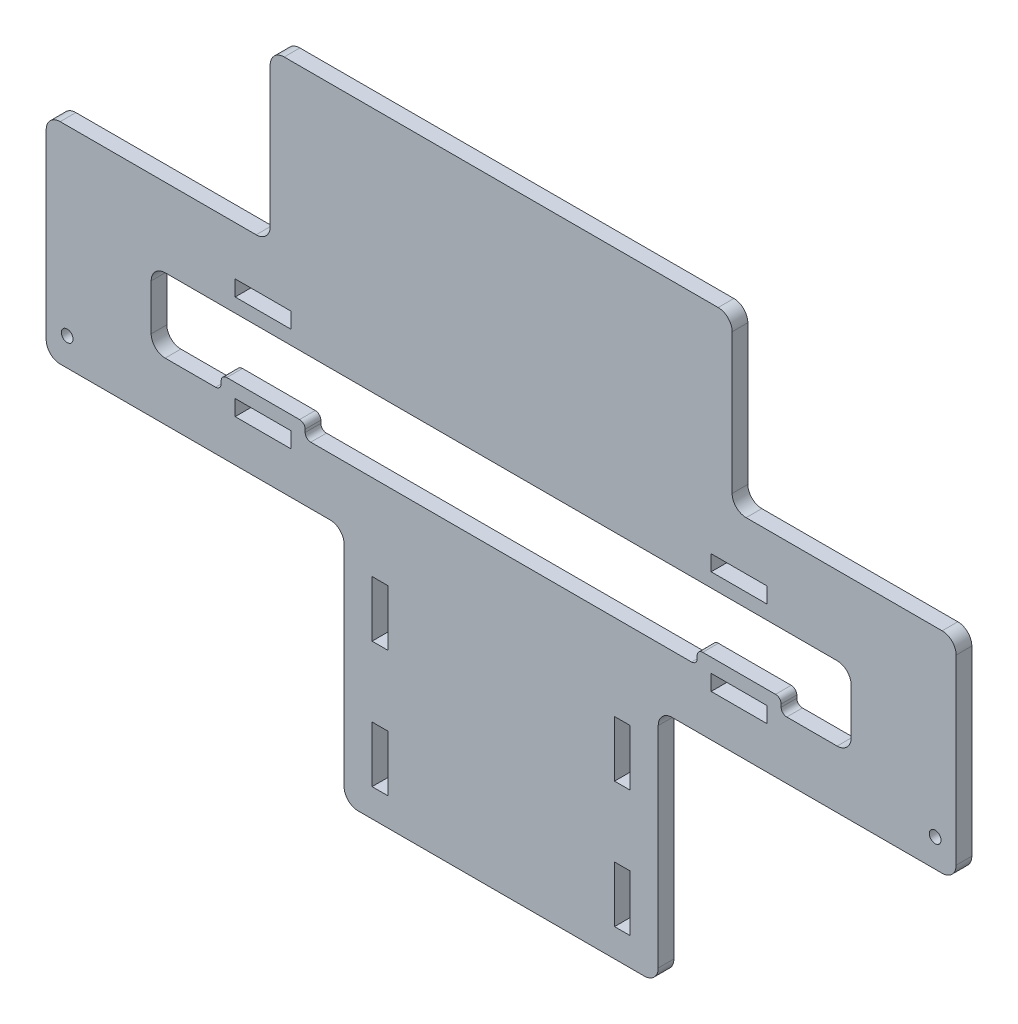
from build123d import *

# Parameters (mm, degrees)
SKETCH_1_W          = 325
SKETCH_1_H          = 230
SKETCH_1_R          = 2.1
EXTRUDE_1_DEPTH     = 5.6
SKETCH_2_W          = 5.6
SKETCH_2_H          = 20
SKETCH_2_W_2        = 20
SKETCH_2_H_2        = 5.6
CUT_EXTRUDE_1_DEPTH = 200.154738834
SKETCH_3_R          = 2.1
SKETCH_3_W          = 56.1
SKETCH_3_H          = 10
CUT_EXTRUDE_2_DEPTH = 200.154738834
CUT_EXTRUDE_3_DEPTH = 200.154738834
SKETCH_5_W          = 80
SKETCH_5_H          = 60
CUT_EXTRUDE_4_DEPTH = 200.154738834
FILLET_1_R          = 5
FILLET_2_R          = 2


with BuildPart() as part:
    # ｽｹｯﾁ1 → ﾎﾞｽ - 押し出し1 (new body)
    with BuildSketch(Plane.XY):
        Rectangle(SKETCH_1_W, SKETCH_1_H)
        with Locations((155, 110)):
            Circle(SKETCH_1_R, mode=Mode.SUBTRACT)
        with Locations(Location((155, -110, 0), (0, 0, 180))):
            Circle(SKETCH_1_R, mode=Mode.SUBTRACT)
        with Locations(Location((-155, 110, 0), (0, 0, 180))):
            Circle(SKETCH_1_R, mode=Mode.SUBTRACT)
        with Locations((-155, -110)):
            Circle(SKETCH_1_R, mode=Mode.SUBTRACT)
        with Locations((155, -10)):
            Circle(SKETCH_1_R, mode=Mode.SUBTRACT)
        with Locations(Location((-155, -10, 0), (0, 0, 180))):
            Circle(SKETCH_1_R, mode=Mode.SUBTRACT)
    extrude(amount=EXTRUDE_1_DEPTH)

    # ｽｹｯﾁ2 → ｶｯﾄ - 押し出し1 (cut, through all)
    with BuildSketch(Plane.XY.offset(5.6)):
        with Locations((43.3, -40)):
            Rectangle(SKETCH_2_W, SKETCH_2_H)
        with Locations((-43.3, -40)):
            Rectangle(SKETCH_2_W, SKETCH_2_H)
        with Locations((43.3, -85)):
            Rectangle(SKETCH_2_W, SKETCH_2_H)
        with Locations((-43.3, -85)):
            Rectangle(SKETCH_2_W, SKETCH_2_H)
        with Locations((85, -2.2)):
            Rectangle(SKETCH_2_W_2, SKETCH_2_H_2)
        with Locations((-85, -2.2)):
            Rectangle(SKETCH_2_W_2, SKETCH_2_H_2)
        with Locations((85, 34.8)):
            Rectangle(SKETCH_2_W_2, SKETCH_2_H_2)
        with Locations((-85, 34.8)):
            Rectangle(SKETCH_2_W_2, SKETCH_2_H_2)
    extrude(amount=-CUT_EXTRUDE_1_DEPTH, mode=Mode.SUBTRACT)

    # ｽｹｯﾁ3 → ｶｯﾄ - 押し出し2 (cut, through all)
    # profile 1 of 4: a face of its own
    with BuildSketch(Plane.XY.offset(5.6)):
        Polygon((-56.1, -115), (-56.1, -105), (-56.1, -20), (-162.5, -20), (-162.5, -115), align=None)
        with Locations((-155, -110)):
            Circle(SKETCH_3_R, mode=Mode.SUBTRACT)
    # profile 2 of 4: a face of its own
    with BuildSketch(Plane.XY.offset(5.6)):
        with Locations((-28.05, -110)):
            Rectangle(SKETCH_3_W, SKETCH_3_H)
    # profile 3 of 4: a face of its own
    with BuildSketch(Plane.XY.offset(5.6)):
        with Locations((28.05, -110)):
            Rectangle(SKETCH_3_W, SKETCH_3_H)
    # profile 4 of 4: a face of its own
    with BuildSketch(Plane.XY.offset(5.6)):
        Polygon((56.1, -20), (56.1, -105), (56.1, -115), (162.5, -115), (162.5, -20), align=None)
        with Locations((155, -110)):
            Circle(SKETCH_3_R, mode=Mode.SUBTRACT)
    extrude(amount=-CUT_EXTRUDE_2_DEPTH, mode=Mode.SUBTRACT)

    # ｽｹｯﾁ4 → ｶｯﾄ - 押し出し3 (cut, through all)
    with BuildSketch(Plane.XY.offset(5.6)):
        Polygon((-125, 27), (125, 27), (125, 5.6), (125, 0.6), (100, 0.6), (100, 5.6), (70, 5.6), (70, 0.6), (-70, 0.6), (-70, 5.6), (-100, 5.6), (-100, 0.6), (-125, 0.6), (-125, 5.6), align=None)
    extrude(amount=-CUT_EXTRUDE_3_DEPTH, mode=Mode.SUBTRACT)

    # ｽｹｯﾁ5 → ｶｯﾄ - 押し出し4 (cut, through all)
    with BuildSketch(Plane.XY.offset(5.6)):
        with Locations((-122.5, 85)):
            Rectangle(SKETCH_5_W, SKETCH_5_H)
        with Locations((122.5, 85)):
            Rectangle(SKETCH_5_W, SKETCH_5_H)
    extrude(amount=-CUT_EXTRUDE_4_DEPTH, mode=Mode.SUBTRACT)

    # ﾌｨﾚｯﾄ1
    fillet_1_edges = [part.edges().sort_by_distance(p)[0] for p in [
        (-162.5, -20, 2.8),
        (-56.1, -20, 2.8),
        (-56.1, -105, 2.8),
        (56.1, -105, 2.8),
        (56.1, -20, 2.8),
        (162.5, -20, 2.8),
        (125, 0.6, 2.8),
        (-125, 0.6, 2.8),
        (-125, 27, 2.8),
        (125, 27, 2.8),
        (-162.5, 55, 2.8),
        (-82.5, 115, 2.8),
        (-82.5, 55, 2.8),
        (82.5, 115, 2.8),
        (162.5, 55, 2.8),
        (82.5, 55, 2.8),
    ]]
    fillet(fillet_1_edges, radius=FILLET_1_R)

    # ﾌｨﾚｯﾄ2
    fillet_2_edges = [part.edges().sort_by_distance(p)[0] for p in [
        (100, 0.6, 2.8),
        (100, 5.6, 2.8),
        (70, 5.6, 2.8),
        (70, 0.6, 2.8),
        (-70, 0.6, 2.8),
        (-70, 5.6, 2.8),
        (-100, 5.6, 2.8),
        (-100, 0.6, 2.8),
    ]]
    fillet(fillet_2_edges, radius=FILLET_2_R)


solid = part.part
